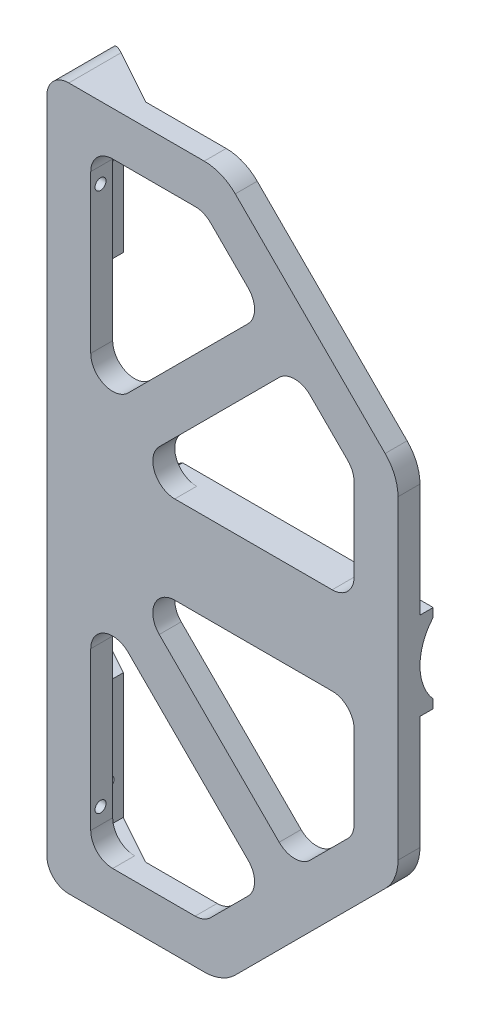
from build123d import *
from build123d.topology import SkipClean

# Parameters (mm, degrees)
RESSALTO_EXTRUS_O2_DEPTH   = 5
CORTE_EXTRUS_O1_DEPTH      = 5
FILETE1_R                  = 10
FILETE2_R                  = 5
ESBO_O7_W                  = 62.928932188
ESBO_O7_H                  = 19.982162149
RESSALTO_EXTRUS_O5_DEPTH   = 5
CORTE_EXTRUS_O2_DEPTH      = 66
FILETE3_R                  = 5
CORTE_EXTRUS_O5_DEPTH      = 35
RESSALTO_EXTRUS_O6_DEPTH   = 159.982162
ESBO_O12_W                 = 11.383352407
ESBO_O12_H                 = 139.982162149
CORTE_EXTRUS_O6_DEPTH      = 10
CORTE_EXTRUS_O7_DEPTH      = 10
CORTE_EXTRUS_O7_DEPTH_BACK = 146.645655307
ESBO_O14_R                 = 1.25
FILETE4_R                  = 5
ESBO_O16_W                 = 30.044355049
ESBO_O16_H                 = 82.897559044
CORTE_EXTRUS_O8_DEPTH      = 262.030945505


with BuildPart() as part:
    # Esboço1 → Ressalto-extrusão2 (new body)
    with BuildSketch(Plane.XY):
        Polygon((-148.870088073, 85.148606513), (-188.870088073, 125.148606513), (-228.870088073, 125.148606513), (-228.870088073, -34.833555636), (-188.870088073, -34.833555636), (-148.870088073, 5.166444364), align=None)
    extrude(amount=RESSALTO_EXTRUS_O2_DEPTH)

    # Esboço4 → Corte-extrusão1 (cut)
    with BuildSketch(Plane(origin=(0, 0, 0), x_dir=(-1, 0, 0), z_dir=(0, 0, -1))):
        Polygon((179.47668979, 101.613072607), (218.870088073, 62.219674325), (218.870088073, 115.148606513), (193.012223696, 115.148606513), align=None)
        Polygon((158.870088073, 55.148606513), (211.799020261, 55.148606513), (172.405621979, 94.542004796), (158.870088073, 81.00647089), align=None)
        Polygon((172.405621979, -4.226953918), (211.799020261, 35.166444364), (158.870088073, 35.166444364), (158.870088073, 9.308579988), align=None)
        Polygon((218.870088073, -24.833555636), (218.870088073, 28.095376552), (179.47668979, -11.29802173), (193.012223696, -24.833555636), align=None)
    extrude(amount=-CORTE_EXTRUS_O1_DEPTH, mode=Mode.SUBTRACT)

    # Filete1
    filete1_edges = [part.edges().sort_by_distance(p)[0] for p in [
        (-188.870088073, 125.148606513, 2.5),
        (-148.870088073, 85.148606513, 2.5),
        (-148.870088073, 5.166444364, 2.5),
        (-188.870088073, -34.833555636, 2.5),
    ]]
    fillet(filete1_edges, radius=FILETE1_R)

    # Filete2
    filete2_edges = [part.edges().sort_by_distance(p)[0] for p in [
        (-218.870088073, 115.148606513, 2.5),
        (-218.870088073, -24.833555636, 2.5),
    ]]
    fillet(filete2_edges, radius=FILETE2_R)

    # Esboço7 → Ressalto-extrusão5 (add)
    with BuildSketch(Plane(origin=(0, 0, 0), x_dir=(-1, 0, 0), z_dir=(0, 0, -1))):
        with Locations((180.334554167, 45.157525439)):
            Rectangle(ESBO_O7_W, ESBO_O7_H)
    extrude(amount=RESSALTO_EXTRUS_O5_DEPTH)

    # Esboço8 → Corte-extrusão2 (cut)
    with BuildSketch(Plane(origin=(-148.870088073, 0, 0), x_dir=(0, 0, -1), z_dir=(1, 0, 0))):
        with BuildLine():
            Line((3.009284908, 37.096966334), (3.009284908, 53.218084544))
            ThreePointArc((3.009284908, 53.218084544), (0, 45.157525439), (3.009284908, 37.096966334))
        make_face()
        with BuildLine():
            Line((5, 55.148606513), (3.009284908, 55.148606513))
            Line((3.009284908, 55.148606513), (3.009284908, 53.218084544))
            ThreePointArc((3.009284908, 53.218084544), (3.95384052, 54.192547406), (5, 55.057020375))
            Line((5, 55.057020375), (5, 55.148606513))
        make_face()
        with BuildLine():
            ThreePointArc((5, 55.057020375), (3.95384052, 54.192547406), (3.009284908, 53.218084544))
            Line((3.009284908, 53.218084544), (3.009284908, 37.096966334))
            ThreePointArc((3.009284908, 37.096966334), (3.95384052, 36.122503472), (5, 35.258030502))
            Line((5, 35.258030502), (5, 55.057020375))
        make_face()
        with BuildLine():
            ThreePointArc((5, 35.258030502), (3.95384052, 36.122503472), (3.009284908, 37.096966334))
            Line((3.009284908, 37.096966334), (3.009284908, 35.166444364))
            Line((3.009284908, 35.166444364), (5, 35.166444364))
            Line((5, 35.166444364), (5, 35.258030502))
        make_face()
    extrude(amount=-CORTE_EXTRUS_O2_DEPTH, mode=Mode.SUBTRACT)

    # Filete3
    filete3_edges = [part.edges().sort_by_distance(p)[0] for p in [
        (-218.870088073, 62.219674325, 2.5),
        (-211.799020261, 55.148606513, 2.5),
        (-211.799020261, 35.166444364, 2.5),
        (-218.870088073, 28.095376552, 2.5),
        (-193.012223696, -24.833555636, 2.5),
        (-179.47668979, -11.29802173, 2.5),
        (-172.405621979, -4.226953918, 2.5),
        (-158.870088073, 9.308579988, 2.5),
        (-158.870088073, 55.148606513, 2.5),
        (-179.47668979, 101.613072607, 2.5),
        (-193.012223696, 115.148606513, 2.5),
        (-158.870088073, 81.00647089, 2.5),
        (-172.405621979, 94.542004796, 2.5),
        (-158.870088073, 35.166444364, 2.5),
    ]]
    fillet(filete3_edges, radius=FILETE3_R)

    # Esboço9 → Corte-extrusão5 (cut)
    # profile 1 of 2: a face of its own
    with BuildSketch(Plane(origin=(0, 0, 0), x_dir=(-1, 0, 0), z_dir=(0, 0, -1))):
        with BuildLine():
            Line((148.870088073, 62.717943557), (158.870088073, 61.569782302))
            Line((158.870088073, 61.569782302), (158.870088073, 78.935403078))
            ThreePointArc((158.870088073, 78.935403078), (159.25069041, 80.84882024), (160.334554167, 82.470936984))
            Line((160.334554167, 82.470936984), (168.870088073, 91.00647089))
            ThreePointArc((168.870088073, 91.00647089), (172.405621979, 92.470936984), (175.941155885, 91.00647089))
            Line((175.941155885, 91.00647089), (203.263486355, 63.684140419))
            ThreePointArc((203.263486355, 63.684140419), (204.725855133, 60.003800568), (203.052854861, 56.414302837))
            ThreePointArc((203.052854861, 56.414302837), (204.549488944, 55.877906361), (205.962201401, 55.148606513))
            Line((205.962201401, 55.148606513), (211.799020261, 55.148606513))
            Line((211.799020261, 55.148606513), (211.799020261, 45.157525439))
            Line((211.799020261, 45.157525439), (211.799020261, 35.166444364))
            Line((211.799020261, 35.166444364), (206.85563775, 35.166444364))
            ThreePointArc((206.85563775, 35.166444364), (205.247649008, 34.173056461), (203.503772873, 33.44412344))
            ThreePointArc((203.503772873, 33.44412344), (204.724845816, 29.990215306), (203.263486355, 26.630910458))
            Line((203.263486355, 26.630910458), (175.941155885, -0.691420012))
            ThreePointArc((175.941155885, -0.691420012), (172.405621979, -2.155886106), (168.870088073, -0.691420012))
            Line((168.870088073, -0.691420012), (160.334554167, 7.844113894))
            ThreePointArc((160.334554167, 7.844113894), (159.25069041, 9.466230638), (158.870088073, 11.3796478))
            Line((158.870088073, 11.3796478), (158.870088073, 26.462519889))
            Line((158.870088073, 26.462519889), (148.870088073, 24.901543221))
            Line((148.870088073, 24.901543221), (148.870088073, 9.308579988))
            ThreePointArc((148.870088073, 9.308579988), (149.631292748, 5.481745664), (151.799020261, 2.237512176))
            Line((151.799020261, 2.237512176), (185.941155885, -31.904623448))
            ThreePointArc((185.941155885, -31.904623448), (189.185389373, -34.072350961), (193.012223696, -34.833555636))
            Line((193.012223696, -34.833555636), (228.870088073, -34.833555636))
            Line((228.870088073, -34.833555636), (228.870088073, 125.148606513))
            Line((228.870088073, 125.148606513), (193.012223696, 125.148606513))
            ThreePointArc((193.012223696, 125.148606513), (189.185389373, 124.387401839), (185.941155885, 122.219674325))
            Line((185.941155885, 122.219674325), (151.799020261, 88.077538702))
            ThreePointArc((151.799020261, 88.077538702), (149.631292748, 84.833305213), (148.870088073, 81.00647089))
            Line((148.870088073, 81.00647089), (148.870088073, 62.717943557))
        make_face()
        with BuildLine():
            ThreePointArc((195.083291508, -24.833555636), (193.169874346, -24.452953298), (191.547757602, -23.369089542))
            Line((191.547757602, -23.369089542), (183.012223696, -14.833555636))
            ThreePointArc((183.012223696, -14.833555636), (181.547757602, -11.29802173), (183.012223696, -7.762487824))
            Line((183.012223696, -7.762487824), (210.334554167, 19.559842647))
            ThreePointArc((210.334554167, 19.559842647), (215.783505235, 20.643706403), (218.870088073, 16.024308741))
            Line((218.870088073, 16.024308741), (218.870088073, -19.833555636))
            ThreePointArc((218.870088073, -19.833555636), (217.405621979, -23.369089542), (213.870088073, -24.833555636))
            Line((213.870088073, -24.833555636), (195.083291508, -24.833555636))
        make_face(mode=Mode.SUBTRACT)
        with BuildLine():
            ThreePointArc((218.870088073, 74.290742137), (215.783505235, 69.671344475), (210.334554167, 70.755208231))
            Line((210.334554167, 70.755208231), (183.012223696, 98.077538702))
            ThreePointArc((183.012223696, 98.077538702), (181.547757602, 101.613072607), (183.012223696, 105.148606513))
            Line((183.012223696, 105.148606513), (191.547757602, 113.684140419))
            ThreePointArc((191.547757602, 113.684140419), (193.169874346, 114.768004176), (195.083291508, 115.148606513))
            Line((195.083291508, 115.148606513), (213.870088073, 115.148606513))
            ThreePointArc((213.870088073, 115.148606513), (217.405621979, 113.684140419), (218.870088073, 110.148606513))
            Line((218.870088073, 110.148606513), (218.870088073, 74.290742137))
        make_face(mode=Mode.SUBTRACT)
    # profile 2 of 2: a face of its own
    with BuildSketch(Plane(origin=(0, 0, 0), x_dir=(-1, 0, 0), z_dir=(0, 0, -1))):
        with BuildLine():
            Line((211.799020261, 55.148606513), (205.962201401, 55.148606513))
            ThreePointArc((205.962201401, 55.148606513), (210.218898447, 50.767748707), (211.771557204, 44.860072713))
            ThreePointArc((211.771557204, 44.860072713), (210.472334539, 39.425629442), (206.85563775, 35.166444364))
            Line((206.85563775, 35.166444364), (211.799020261, 35.166444364))
            Line((211.799020261, 35.166444364), (211.799020261, 45.157525439))
            Line((211.799020261, 45.157525439), (211.799020261, 55.148606513))
        make_face()
    extrude(amount=CORTE_EXTRUS_O5_DEPTH, mode=Mode.SUBTRACT)

    # Esboço10 → Ressalto-extrusão6 (add, through all)
    with SkipClean():  # the faces are left unmerged after this step: merging them gives an invalid solid
        with BuildSketch(Plane.XZ.offset(34.833555636)):
            Polygon((-211.358378387, 0), (-228.870088073, 0), (-228.870088073, -9.667656613), align=None)
        extrude(amount=-RESSALTO_EXTRUS_O6_DEPTH)

    # Esboço12 → Corte-extrusão6 (cut)
    with SkipClean():  # the faces are left unmerged after this step: merging them gives an invalid solid
        with BuildSketch(Plane.XY):
            with Locations((-217.05005459, 45.157525439)):
                Rectangle(ESBO_O12_W, ESBO_O12_H)
        extrude(amount=-CORTE_EXTRUS_O6_DEPTH, mode=Mode.SUBTRACT)

    # Esboço14 → Corte-extrusão7 (cut, two sides: drawn at the far end of the back side and taken through both)
    with SkipClean():  # the faces are left unmerged after this step: merging them gives an invalid solid
        with BuildSketch(Plane(origin=(-222.741730794, 0, 0), x_dir=(0, 0, -1), z_dir=(1, 0, 0)).offset(-CORTE_EXTRUS_O7_DEPTH_BACK)):
            with Locations(Location((2.934607414, 106.56846675, 0), (0, 0, 180))):
                Circle(ESBO_O14_R)
            with Locations(Location((-2.768365458, 106.56846675, 0), (0, 0, 180))):
                Circle(ESBO_O14_R)
            with Locations(Location((-2.768365458, -16.253415872, 0), (0, 0, 180))):
                Circle(ESBO_O14_R)
            with Locations(Location((2.934607414, -16.253415872, 0), (0, 0, 180))):
                Circle(ESBO_O14_R)
        extrude(amount=CORTE_EXTRUS_O7_DEPTH + CORTE_EXTRUS_O7_DEPTH_BACK, mode=Mode.SUBTRACT)

    # Filete4
    filete4_edges = [part.edges().sort_by_distance(p)[0] for p in [
        (-228.870088073, -34.833555636, -4.833828306),
        (-228.870088073, 125.148606364, -4.833828306),
    ]]
    fillet(filete4_edges, radius=FILETE4_R)

    # Esboço16 → Corte-extrusão8 (cut, through all)
    with SkipClean():  # the faces are left unmerged after this step: merging them gives an invalid solid
        with BuildSketch(Plane(origin=(0, 0, 0), x_dir=(-1, 0, 0), z_dir=(0, 0, -1))):
            with Locations((222.741730795, 45.157525439)):
                Rectangle(ESBO_O16_W, ESBO_O16_H)
        extrude(amount=CORTE_EXTRUS_O8_DEPTH, mode=Mode.SUBTRACT)


solid = part.part
